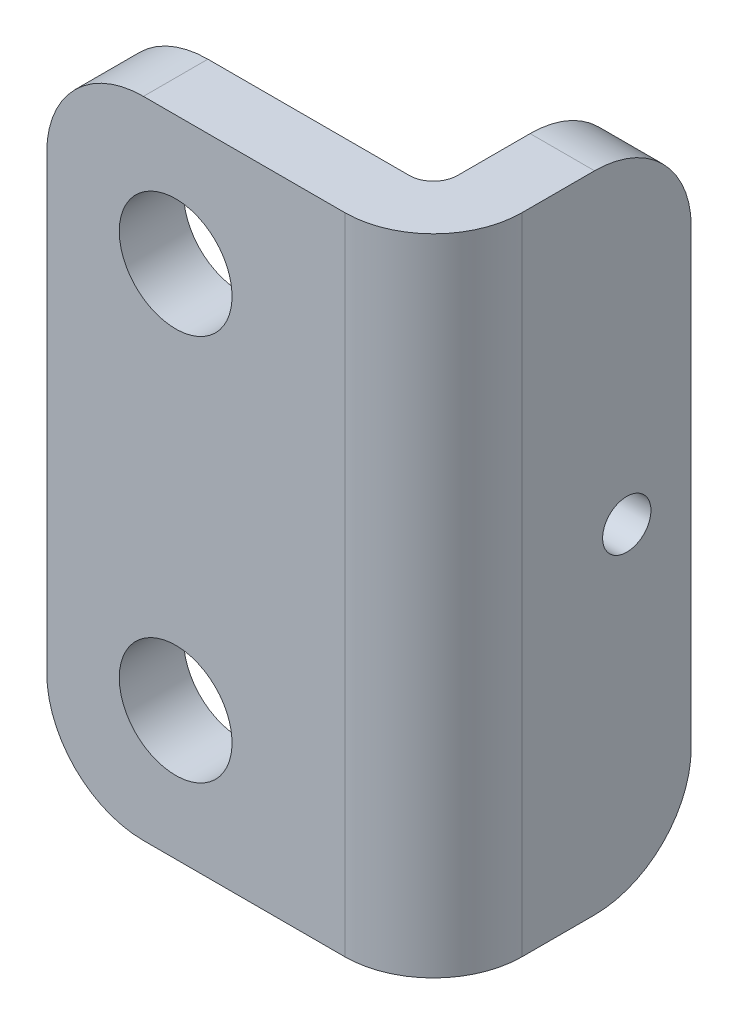
from build123d import *

# Parameters (mm, degrees)
BOSS_EXTRUDE1_DEPTH = 20
FILLET1_R           = 3
SKETCH3_R           = 1.75
CUT_EXTRUDE1_DEPTH  = 24.600847442
SKETCH4_R           = 0.75
CUT_EXTRUDE2_DEPTH  = 24.430749028


with BuildPart() as part:
    # Sketch2 → Boss-Extrude1 (new body)
    with BuildSketch(Plane(origin=(0, 0, 0), x_dir=(1, 0, 0), z_dir=(0, 1, 0))):
        with BuildLine():
            Line((-1, 7), (1, 7))
            Line((1, 7), (1, 1.75))
            ThreePointArc((1, 1.75), (0.194543648, -0.194543648), (-1.75, -1))
            Line((-1.75, -1), (-11, -1))
            Line((-11, -1), (-11, 1))
            Line((-11, 1), (-1.75, 1))
            ThreePointArc((-1.75, 1), (-1.219669914, 1.219669914), (-1, 1.75))
            Line((-1, 1.75), (-1, 7))
        make_face()
    extrude(amount=BOSS_EXTRUDE1_DEPTH)

    # Fillet1
    fillet1_edges = [part.edges().sort_by_distance(p)[0] for p in [
        (-11, 0, 0),
        (-11, 20, 0),
        (0, 20, -7),
        (0, 0, -7),
    ]]
    fillet(fillet1_edges, radius=FILLET1_R)

    # Sketch3 → Cut-Extrude1 (cut, through all)
    with BuildSketch(Plane(origin=(0, 0, -1), x_dir=(-1, 0, 0), z_dir=(0, 0, -1))):
        with Locations((7, 16)):
            Circle(SKETCH3_R)
        with Locations((7, 4)):
            Circle(SKETCH3_R)
    extrude(amount=-CUT_EXTRUDE1_DEPTH, mode=Mode.SUBTRACT)

    # Sketch4 → Cut-Extrude2 (cut, through all)
    with BuildSketch(Plane.ZY.offset(1)):
        with Locations((-5, 10)):
            Circle(SKETCH4_R)
    extrude(amount=-CUT_EXTRUDE2_DEPTH, mode=Mode.SUBTRACT)


solid = part.part
